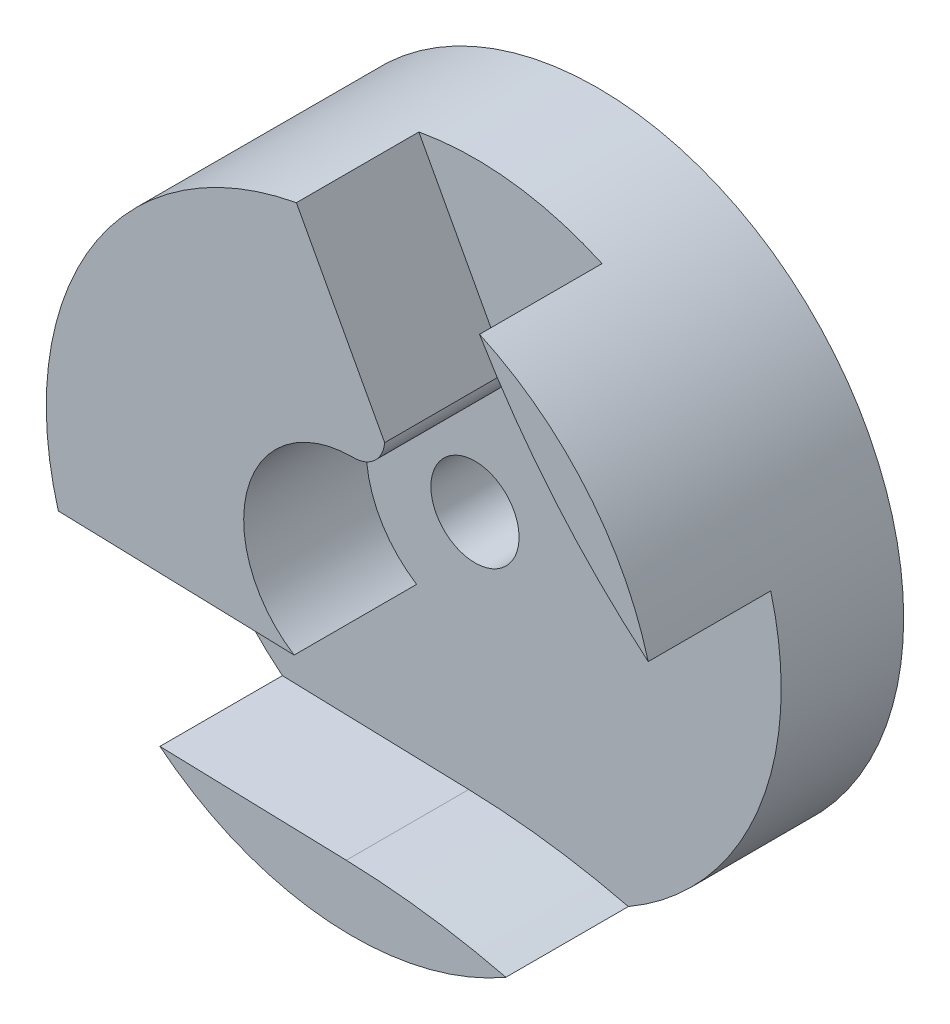
from build123d import *

# Parameters (mm, degrees)
CROQUIS2_R              = 15
SALIENTE_EXTRUIR1_DEPTH = 6
CROQUIS3_R              = 2.159
CORTAR_EXTRUIR1_DEPTH   = 6
SALIENTE_EXTRUIR2_DEPTH = 6


with BuildPart() as part:
    # Croquis2 → Saliente-Extruir1 (new body)
    with BuildSketch(Plane.XY):
        with Locations((-0.424832659, 0)):
            Circle(CROQUIS2_R)
    extrude(amount=SALIENTE_EXTRUIR1_DEPTH)

    # Croquis3 → Cortar-Extruir1 (cut)
    with BuildSketch(Plane(origin=(0, 0, 0), x_dir=(-1, 0, 0), z_dir=(0, 0, -1))):
        with Locations((0.424832659, 0)):
            Circle(CROQUIS3_R)
    extrude(amount=-CORTAR_EXTRUIR1_DEPTH, mode=Mode.SUBTRACT)

    # Croquis5 → Saliente-Extruir2 (add)
    with BuildSketch(Plane.XY.offset(6)):
        with BuildLine():
            Line((1.150657303, 6.727260511), (-3.173951667, 14.745926376))
            ThreePointArc((-3.173951667, 14.745926376), (-13.192330391, 7.873436458), (-14.835285649, -4.16399383))
            Line((-14.835285649, -4.16399383), (-3.282721328, -4.499041271))
            ThreePointArc((-3.282721328, -4.499041271), (-5.537081833, 1.507915241), (-0.38358243, 5.329840374))
            ThreePointArc((-0.38358243, 5.329840374), (0.657157734, 5.728140337), (1.150657303, 6.727260511))
        make_face()
        with BuildLine():
            ThreePointArc((14.060690832, 3.894818251), (11.020642477, 9.695416387), (5.798891595, 13.647903004))
            ThreePointArc((5.798891595, 13.647903004), (9.512311917, 8.417715579), (14.060690832, 3.894818251))
        make_face()
        with BuildLine():
            Line((-0.730311074, -11.926156717), (-9.859444413, -11.661393616))
            ThreePointArc((-9.859444413, -11.661393616), (-1.589548178, -14.954712895), (7.090520152, -12.981505003))
            ThreePointArc((7.090520152, -12.981505003), (3.207869051, -12.248077397), (-0.730311074, -11.926156717))
        make_face()
    extrude(amount=SALIENTE_EXTRUIR2_DEPTH)


solid = part.part
